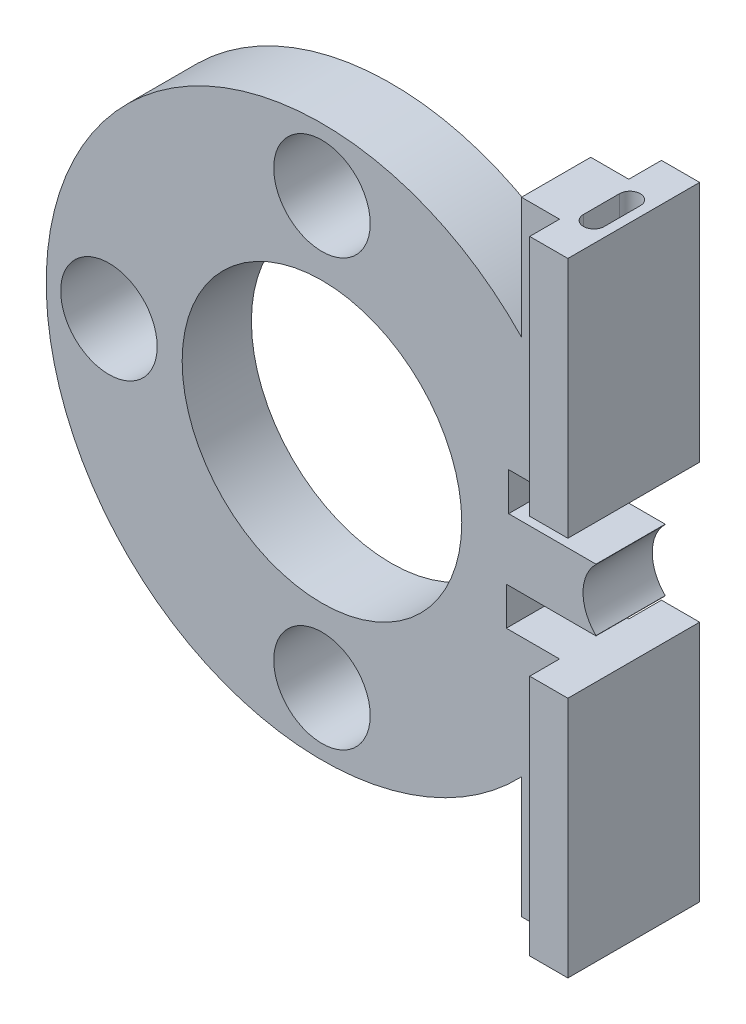
from build123d import *

# Parameters (mm, degrees)
SKETCH_1_R               = 39.827146721
SKETCH_1_R_2             = 20.192313572
SKETCH_1_R_3             = 6.968422522
EXTRUDE_1_DEPTH          = 10
EXTRUDE_4_DEPTH          = 25
EXTRUDE_4_DEPTH_BACK     = 10
SKETCH_9_W               = 5.512948522
SKETCH_9_H               = 19.029248926
SKETCH_9_W_2             = 5.494108899
SKETCH_9_H_2             = 10
EXTRUDE_5_DEPTH          = 10
EXTRUDE_5_DEPTH_BACK     = 25
SKETCH_10_W              = 5.512948523
SKETCH_10_H              = 19.029248926
SKETCH_10_W_2            = 5.494108899
SKETCH_10_H_2            = 10
CUT_EXTRUDE_3_DEPTH      = 30
CUT_EXTRUDE_3_DEPTH_BACK = 30
SKETCH_11_R              = 6.215767845
SKETCH_11_W              = 17.292355096
SKETCH_11_H              = 5.512218416


with BuildPart() as part:
    # 草图1 → 凸台-拉伸1 (new body)
    with BuildSketch(Plane.XY):
        Circle(SKETCH_1_R)
        Circle(SKETCH_1_R_2, mode=Mode.SUBTRACT)
        with Locations((0, 30.769644044)):
            Circle(SKETCH_1_R_3, mode=Mode.SUBTRACT)
        with Locations((0, -30.769644044)):
            Circle(SKETCH_1_R_3, mode=Mode.SUBTRACT)
        with Locations((-30.769644044, 0)):
            Circle(SKETCH_1_R_3, mode=Mode.SUBTRACT)
    extrude(amount=EXTRUDE_1_DEPTH)

    # 草图9 → 凸台-拉伸4 (add, two sides: drawn at the far end of the back side and taken through both)
    # profile 1 of 2: a face of its own
    with BuildSketch(Plane(origin=(0, 20, 0), x_dir=(1, 0, 0), z_dir=(0, 1, 0)).offset(-EXTRUDE_4_DEPTH_BACK)):
        with Locations((37.067708268, -4.794824214)):
            Rectangle(SKETCH_9_W, SKETCH_9_H)
        with BuildLine():
            ThreePointArc((35.447720425, -7.685496918), (36.952141211, -9.189917704), (38.456561997, -7.685496918))
            Line((38.456561997, -7.685496918), (38.456561997, -2.475743455))
            ThreePointArc((38.456561997, -2.475743455), (36.952141211, -0.971322669), (35.447720425, -2.475743455))
            Line((35.447720425, -2.475743455), (35.447720425, -7.685496918))
        make_face(mode=Mode.SUBTRACT)
    # profile 2 of 2: a face of its own
    with BuildSketch(Plane(origin=(0, 20, 0), x_dir=(1, 0, 0), z_dir=(0, 1, 0)).offset(-EXTRUDE_4_DEPTH_BACK)):
        with Locations((31.564179558, -4.999991318)):
            Rectangle(SKETCH_9_W_2, SKETCH_9_H_2)
    extrude(amount=EXTRUDE_4_DEPTH + EXTRUDE_4_DEPTH_BACK)

    # 草图10 → 凸台-拉伸5 (add, two sides: drawn at the far end of the back side and taken through both)
    # profile 1 of 2: a face of its own
    with BuildSketch(Plane(origin=(0, -20, 0), x_dir=(1, 0, 0), z_dir=(0, 1, 0)).offset(-EXTRUDE_5_DEPTH_BACK)):
        with Locations((37.067757535, -4.794829971)):
            Rectangle(SKETCH_10_W, SKETCH_10_H)
        with BuildLine():
            ThreePointArc((35.447769691, -7.685502675), (36.952190477, -9.189923461), (38.456611263, -7.685502675))
            Line((38.456611263, -7.685502675), (38.456611263, -2.475749212))
            ThreePointArc((38.456611263, -2.475749212), (36.952190477, -0.971328426), (35.447769691, -2.475749212))
            Line((35.447769691, -2.475749212), (35.447769691, -7.685502675))
        make_face(mode=Mode.SUBTRACT)
    # profile 2 of 2: a face of its own
    with BuildSketch(Plane(origin=(0, -20, 0), x_dir=(1, 0, 0), z_dir=(0, 1, 0)).offset(-EXTRUDE_5_DEPTH_BACK)):
        with Locations((31.564228824, -4.999997076)):
            Rectangle(SKETCH_10_W_2, SKETCH_10_H_2)
    extrude(amount=EXTRUDE_5_DEPTH + EXTRUDE_5_DEPTH_BACK)

    # 草图11 → 切除-拉伸3 (cut, two sides: drawn at the far end of the back side and taken through both)
    with BuildSketch(Plane.XY.offset(-CUT_EXTRUDE_3_DEPTH_BACK)):
        with BuildLine():
            ThreePointArc((39.615066117, 4.486072646), (37.701733016, -0.005715671), (39.62332367, -4.493977606))
            Line((39.62332367, -4.493977606), (43.917498233, -4.493977606))
            Line((43.917498233, -4.493977606), (43.917498233, -6.215767845))
            ThreePointArc((43.917498233, -6.215767845), (48.312709827, -4.395211593), (50.133266078, 0))
            ThreePointArc((50.133266078, 0), (48.429223467, 4.275523982), (44.251416636, 6.206792118))
            Line((44.251416636, 6.206792118), (44.251416636, 4.486072646))
            Line((44.251416636, 4.486072646), (39.615066117, 4.486072646))
        make_face()
        with Locations((43.917498233, 0)):
            Circle(SKETCH_11_R)
        with Locations((35.605239088, 7.242181854)):
            Rectangle(SKETCH_11_W, SKETCH_11_H)
        with Locations((35.271320685, -7.250086814)):
            Rectangle(SKETCH_11_W, SKETCH_11_H)
    extrude(amount=CUT_EXTRUDE_3_DEPTH + CUT_EXTRUDE_3_DEPTH_BACK, mode=Mode.SUBTRACT)


solid = part.part
